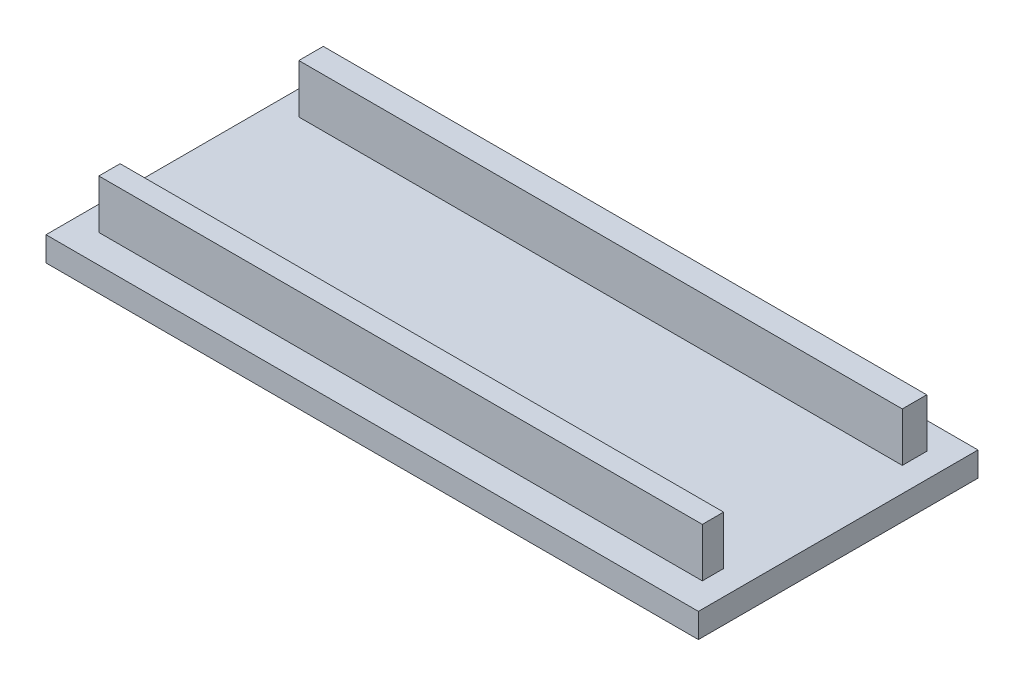
from build123d import *

# Parameters (mm, degrees)
SKETCH_2_W      = 53.34
SKETCH_2_H      = 22.86
EXTRUDE_1_DEPTH = 2
SKETCH_3_W      = 49.34
SKETCH_3_H      = 2
SKETCH_3_H_2    = 1.739417759
EXTRUDE_2_DEPTH = 4


with BuildPart() as part:
    # 草图2 → 凸台-拉伸1 (new body)
    with BuildSketch(Plane(origin=(0, 0, 0), x_dir=(1, 0, 0), z_dir=(0, 1, 0))):
        with Locations((-22.9915138, -6.987515051)):
            Rectangle(SKETCH_2_W, SKETCH_2_H)
    extrude(amount=EXTRUDE_1_DEPTH)

    # 草图3 → 凸台-拉伸2 (add)
    with BuildSketch(Plane(origin=(0, 2, 0), x_dir=(1, 0, 0), z_dir=(0, 1, 0))):
        with Locations((-22.9915138, 1.252704328)):
            Rectangle(SKETCH_3_W, SKETCH_3_H)
        with Locations((-22.9915138, -15.227734431)):
            Rectangle(SKETCH_3_W, SKETCH_3_H_2)
    extrude(amount=EXTRUDE_2_DEPTH)


solid = part.part
